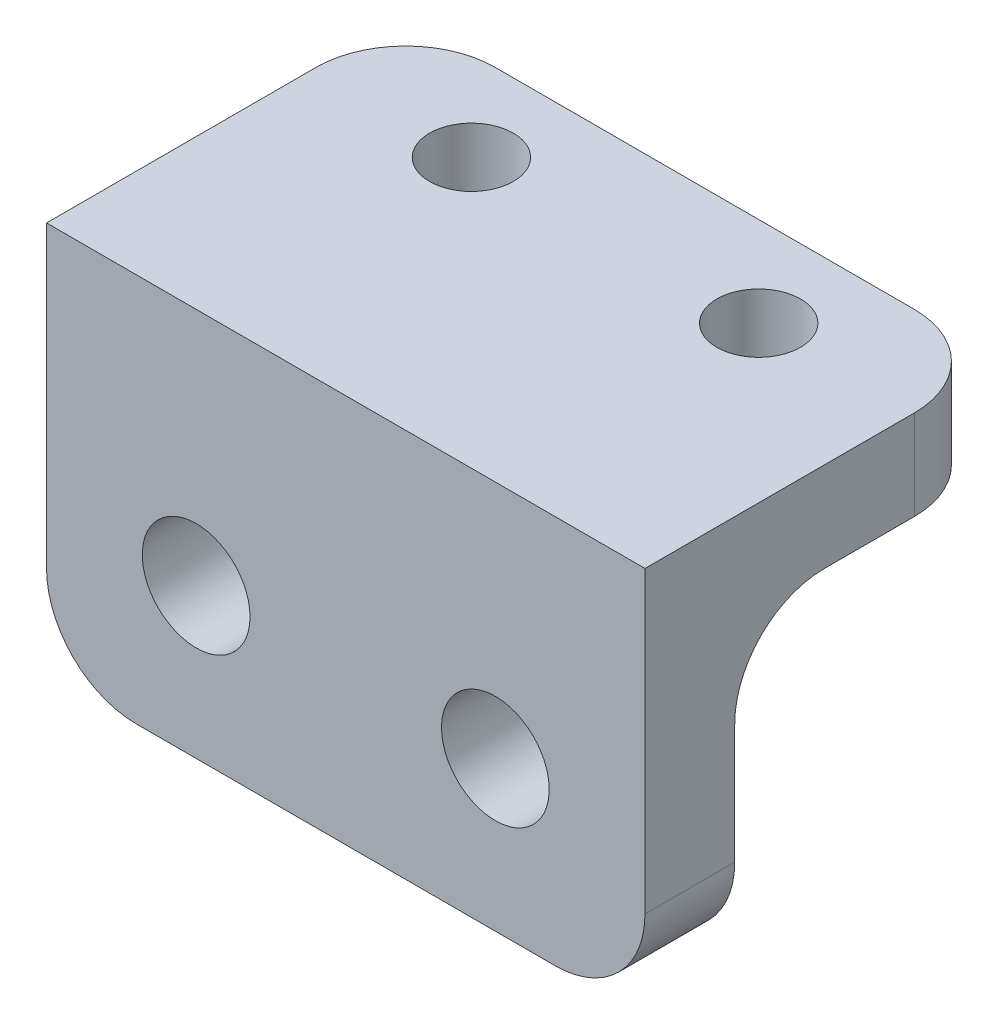
from build123d import *

# Parameters (mm, degrees)
SKETCH1_W           = 20
SKETCH1_H           = 10
SKETCH1_R           = 1.8
BOSS_EXTRUDE1_DEPTH = 3
SKETCH2_W           = 20
SKETCH2_H           = 12
SKETCH2_R           = 1.4
BOSS_EXTRUDE2_DEPTH = 3
FILLET1_R           = 3


with BuildPart() as part:
    # Sketch1 → Boss-Extrude1 (new body)
    with BuildSketch(Plane.XY):
        Rectangle(SKETCH1_W, SKETCH1_H)
        with Locations((-5, 0)):
            Circle(SKETCH1_R, mode=Mode.SUBTRACT)
        with Locations(Location((5, 0, 0), (0, 0, 180))):
            Circle(SKETCH1_R, mode=Mode.SUBTRACT)
    extrude(amount=BOSS_EXTRUDE1_DEPTH)

    # Sketch2 → Boss-Extrude2 (add)
    with BuildSketch(Plane(origin=(0, 5, 0), x_dir=(1, 0, 0), z_dir=(0, 1, 0))):
        with Locations((0, 3)):
            Rectangle(SKETCH2_W, SKETCH2_H)
        with Locations(Location((4.8, 6, 0), (0, 0, 270))):
            Circle(SKETCH2_R, mode=Mode.SUBTRACT)
        with Locations(Location((-4.8, 6, 0), (0, 0, 90))):
            Circle(SKETCH2_R, mode=Mode.SUBTRACT)
    extrude(amount=BOSS_EXTRUDE2_DEPTH)

    # Fillet1
    fillet1_edges = [part.edges().sort_by_distance(p)[0] for p in [
        (-10, 6.5, -9),
        (10, 6.5, -9),
        (0, 5, 0),
        (10, -5, 1.5),
        (-10, -5, 1.5),
    ]]
    fillet(fillet1_edges, radius=FILLET1_R)


solid = part.part
